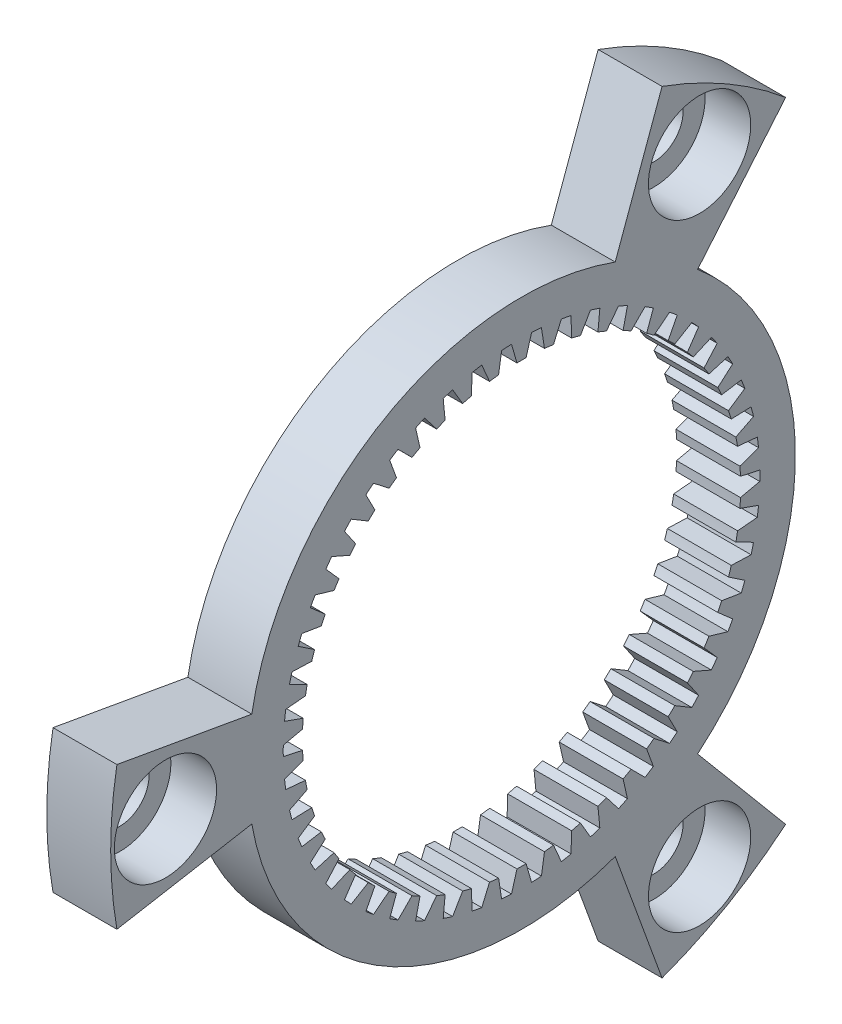
from build123d import *

# Parameters (mm, degrees)
SKETCH1_W                                        = 3.5
SKETCH1_H                                        = 22.5
CUT_EXTRUDE1_DEPTH                               = 33.011716605
CUT_EXTRUDE2_DEPTH                               = 33.011716605
CUT_EXTRUDE3_DEPTH                               = 33.011716605
CUT_EXTRUDE4_DEPTH                               = 32.07297861
CBORE_FOR_M3_HEX_HEAD_MACHINE_SCREW1_D           = 3.2
CBORE_FOR_M3_HEX_HEAD_MACHINE_SCREW1_CBORE_D     = 5.6
CBORE_FOR_M3_HEX_HEAD_MACHINE_SCREW1_CBORE_DEPTH = 2.5


with BuildPart() as part:
    # Sketch1 → Revolve1 (revolve)
    with BuildSketch(Plane.XY, mode=Mode.PRIVATE) as revolve1_sk:
        with Locations((0.25, 11.25)):
            Rectangle(SKETCH1_W, SKETCH1_H)
    revolve(revolve1_sk.sketch.rotate(Axis((-1.5, 0, 0), (1, 0, 0)), 270), axis=Axis((-1.5, 0, 0), (1, 0, 0)))

    # Sketch2 → Cut-Extrude1 (cut, through all)
    with BuildSketch(Plane.ZY.offset(1.5)):
        with BuildLine():
            Line((22.158174437, -3.907084003), (14.77211629, -2.604722668))
            ThreePointArc((14.77211629, -2.604722668), (7.499999995, -12.990381056), (-5.130302151, -14.095389311))
            Line((-5.130302151, -14.095389311), (-7.695453225, -21.143083968))
            ThreePointArc((-7.695453225, -21.143083968), (11.249999994, -19.485571584), (22.158174437, -3.907084003))
        make_face()
    extrude(amount=-CUT_EXTRUDE1_DEPTH, mode=Mode.SUBTRACT)

    # Sketch3 → Cut-Extrude2 (cut, through all)
    with BuildSketch(Plane.ZY.offset(1.5)):
        with BuildLine():
            Line((-14.462721218, -17.23599997), (-9.641814144, -11.490666648))
            ThreePointArc((-9.641814144, -11.490666648), (-14.999999996, -2e-09), (-9.641814142, 11.490666643))
            Line((-9.641814142, 11.490666643), (-14.462721215, 17.235999966))
            ThreePointArc((-14.462721215, 17.235999966), (-22.499999996, -1e-09), (-14.462721218, -17.23599997))
        make_face()
    extrude(amount=-CUT_EXTRUDE2_DEPTH, mode=Mode.SUBTRACT)

    # Sketch4 → Cut-Extrude3 (cut, through all)
    with BuildSketch(Plane.ZY.offset(1.5)):
        with BuildLine():
            Line((-7.695453229, 21.143083966), (-5.130302153, 14.095389311))
            ThreePointArc((-5.130302153, 14.095389311), (7.500000001, 12.990381056), (14.772116296, 2.60472266))
            Line((14.772116296, 2.60472266), (22.158174444, 3.90708399))
            ThreePointArc((22.158174444, 3.90708399), (11.250000001, 19.485571584), (-7.695453229, 21.143083966))
        make_face()
    extrude(amount=-CUT_EXTRUDE3_DEPTH, mode=Mode.SUBTRACT)

    # Sketch5 → Cut-Extrude4 (cut, through all)
    with BuildSketch(Plane.ZY.offset(1.5)):
        with BuildLine():
            Line((11.958023801, 1.002829383), (12.978235019, 1.366717155))
            ThreePointArc((12.978235019, 1.366717155), (12.947096852, 1.635598699), (12.910388636, 1.903776582))
            Line((12.910388636, 1.903776582), (11.83173402, 2.002515937))
            ThreePointArc((11.83173402, 2.002515937), (11.787447009, 2.248575775), (11.738043363, 2.493659563))
            Line((11.738043363, 2.493659563), (12.704602679, 2.982544343))
            ThreePointArc((12.704602679, 2.982544343), (12.640010253, 3.245403028), (12.569979891, 3.506865488))
            Line((12.569979891, 3.506865488), (11.487455466, 3.469634984))
            ThreePointArc((11.487455466, 3.469634984), (11.412678196, 3.708203932), (11.332946969, 3.945163242))
            Line((11.332946969, 3.945163242), (12.230611166, 4.551335025))
            ThreePointArc((12.230611166, 4.551335025), (12.133583141, 4.804025412), (12.031335054, 5.05464903))
            Line((12.031335054, 5.05464903), (10.962012876, 4.882035815))
            ThreePointArc((10.962012876, 4.882035815), (10.85792463, 5.109351498), (10.749123231, 5.33444934))
            Line((10.749123231, 5.33444934), (11.563735608, 6.048348435))
            ThreePointArc((11.563735608, 6.048348435), (11.435802174, 6.286885447), (11.302948875, 6.522717741))
            Line((11.302948875, 6.522717741), (10.263692795, 6.217444025))
            ThreePointArc((10.263692795, 6.217444025), (10.131935106, 6.429921539), (9.995779399, 6.639607986))
            Line((9.995779399, 6.639607986), (10.714493032, 7.449975777))
            ThreePointArc((10.714493032, 7.449975777), (10.557671777, 7.670597542), (10.396308442, 7.887919293))
            Line((10.396308442, 7.887919293), (9.403508148, 7.454799428))
            ThreePointArc((9.403508148, 7.454799428), (9.246158914, 7.649087876), (9.084796155, 7.840056047))
            Line((9.084796155, 7.840056047), (9.6962765, 8.73411255))
            ThreePointArc((9.6962765, 8.73411255), (9.513040588, 8.933339732), (9.325712014, 9.128723647))
            Line((9.325712014, 9.128723647), (8.39502456, 8.574588191))
            ThreePointArc((8.39502456, 8.574588191), (8.21456527, 8.74762353), (8.030540244, 8.916861745))
            Line((8.030540244, 8.916861745), (8.525143895, 9.880507151))
            ThreePointArc((8.525143895, 9.880507151), (8.318383067, 10.055197817), (8.108043537, 10.225562576))
            Line((8.108043537, 10.225562576), (7.254146419, 9.559150576))
            ThreePointArc((7.254146419, 9.559150576), (7.053423027, 9.708203933), (6.849637921, 9.853043203))
            Line((6.849637921, 9.853043203), (7.219564679, 10.871080252))
            ThreePointArc((7.219564679, 10.871080252), (6.992539674, 11.018479428), (6.762506366, 11.161138278))
            Line((6.762506366, 11.161138278), (5.998866056, 10.392959446))
            ThreePointArc((5.998866056, 10.392959446), (5.781044088, 10.515680161), (5.560712715, 10.633836283))
            Line((5.560712715, 10.633836283), (5.800128615, 11.690209923))
            ThreePointArc((5.800128615, 11.690209923), (5.556419755, 11.807993035), (5.310320434, 11.920696158))
            Line((5.310320434, 11.920696158), (4.648979992, 11.062865137))
            ThreePointArc((4.648979992, 11.062865137), (4.417494632, 11.157317831), (4.184091749, 11.246927413))
            Line((4.184091749, 11.246927413), (4.289221057, 12.324978001))
            ThreePointArc((4.289221057, 12.324978001), (4.032671777, 12.411287537), (3.774387577, 12.492257539))
            Line((3.774387577, 12.492257539), (3.225776736, 11.558302836))
            ThreePointArc((3.225776736, 11.558302836), (2.984278646, 11.622997933), (2.741485156, 11.682647779))
            Line((2.741485156, 11.682647779), (2.710669922, 12.765373812))
            ThreePointArc((2.710669922, 12.765373812), (2.445326155, 12.818848622), (2.17893037, 12.866808557))
            Line((2.17893037, 12.866808557), (1.751701054, 11.871459195))
            ThreePointArc((1.751701054, 11.871459195), (1.503998804, 11.905376416), (1.255643705, 11.934125811))
            Line((1.255643705, 11.934125811), (1.089369902, 13.004452054))
            ThreePointArc((1.089369902, 13.004452054), (0.81941628, 13.024248806), (0.549110132, 13.038442317))
            Line((0.549110132, 13.038442317), (0.25, 11.997395551))
            ThreePointArc((0.25, 11.997395551), (1e-09, 12), (-0.249999997, 11.997395551))
            Line((-0.249999997, 11.997395551), (-0.549110132, 13.038442317))
            ThreePointArc((-0.549110132, 13.038442317), (-0.819416279, 13.024248806), (-1.0893699, 13.004452054))
            Line((-1.0893699, 13.004452054), (-1.255643703, 11.934125812))
            ThreePointArc((-1.255643703, 11.934125812), (-1.503998803, 11.905376416), (-1.751701056, 11.871459195))
            Line((-1.751701056, 11.871459195), (-2.17893037, 12.866808557))
            ThreePointArc((-2.17893037, 12.866808557), (-2.445326153, 12.818848622), (-2.710669918, 12.765373813))
            Line((-2.710669918, 12.765373813), (-2.741485155, 11.68264778))
            ThreePointArc((-2.741485155, 11.68264778), (-2.984278646, 11.622997933), (-3.225776737, 11.558302836))
            Line((-3.225776737, 11.558302836), (-3.774387576, 12.492257539))
            ThreePointArc((-3.774387576, 12.492257539), (-4.032671778, 12.411287537), (-4.289221059, 12.324978))
            Line((-4.289221059, 12.324978), (-4.184091749, 11.246927413))
            ThreePointArc((-4.184091749, 11.246927413), (-4.417494632, 11.157317831), (-4.648979992, 11.062865137))
            Line((-4.648979992, 11.062865137), (-5.310320434, 11.920696158))
            ThreePointArc((-5.310320434, 11.920696158), (-5.556419755, 11.807993035), (-5.800128615, 11.690209923))
            Line((-5.800128615, 11.690209923), (-5.560712716, 10.633836283))
            ThreePointArc((-5.560712716, 10.633836283), (-5.781044089, 10.515680161), (-5.998866056, 10.392959446))
            Line((-5.998866056, 10.392959446), (-6.762506367, 11.161138277))
            ThreePointArc((-6.762506367, 11.161138277), (-6.992539674, 11.018479428), (-7.219564678, 10.871080253))
            Line((-7.219564678, 10.871080253), (-6.849637922, 9.853043202))
            ThreePointArc((-6.849637922, 9.853043202), (-7.053423027, 9.708203933), (-7.254146418, 9.559150576))
            Line((-7.254146418, 9.559150576), (-8.108043535, 10.225562578))
            ThreePointArc((-8.108043535, 10.225562578), (-8.318383066, 10.055197818), (-8.525143896, 9.880507151))
            Line((-8.525143896, 9.880507151), (-8.030540246, 8.916861744))
            ThreePointArc((-8.030540246, 8.916861744), (-8.21456527, 8.74762353), (-8.395024558, 8.574588192))
            Line((-8.395024558, 8.574588192), (-9.325712013, 9.128723648))
            ThreePointArc((-9.325712013, 9.128723648), (-9.513040588, 8.933339732), (-9.696276499, 8.73411255))
            Line((-9.696276499, 8.73411255), (-9.084796153, 7.840056049))
            ThreePointArc((-9.084796153, 7.840056049), (-9.246158912, 7.649087878), (-9.403508146, 7.45479943))
            Line((-9.403508146, 7.45479943), (-10.396308442, 7.887919294))
            ThreePointArc((-10.396308442, 7.887919294), (-10.557671776, 7.670597543), (-10.714493031, 7.449975778))
            Line((-10.714493031, 7.449975778), (-9.995779398, 6.639607987))
            ThreePointArc((-9.995779398, 6.639607987), (-10.131935107, 6.429921539), (-10.263692796, 6.217444023))
            Line((-10.263692796, 6.217444023), (-11.302948876, 6.52271774))
            ThreePointArc((-11.302948876, 6.52271774), (-11.435802174, 6.286885448), (-11.563735606, 6.048348438))
            Line((-11.563735606, 6.048348438), (-10.749123231, 5.334449341))
            ThreePointArc((-10.749123231, 5.334449341), (-10.85792463, 5.109351498), (-10.962012877, 4.882035814))
            Line((-10.962012877, 4.882035814), (-12.031335054, 5.054649031))
            ThreePointArc((-12.031335054, 5.054649031), (-12.133583141, 4.804025412), (-12.230611166, 4.551335023))
            Line((-12.230611166, 4.551335023), (-11.332946969, 3.945163242))
            ThreePointArc((-11.332946969, 3.945163242), (-11.412678196, 3.708203932), (-11.487455466, 3.469634984))
            Line((-11.487455466, 3.469634984), (-12.569979891, 3.506865487))
            ThreePointArc((-12.569979891, 3.506865487), (-12.640010253, 3.245403027), (-12.704602679, 2.982544343))
            Line((-12.704602679, 2.982544343), (-11.738043363, 2.493659563))
            ThreePointArc((-11.738043363, 2.493659563), (-11.787447009, 2.248575775), (-11.83173402, 2.002515937))
            Line((-11.83173402, 2.002515937), (-12.910388636, 1.90377658))
            ThreePointArc((-12.910388636, 1.90377658), (-12.947096852, 1.635598698), (-12.978235019, 1.366717156))
            Line((-12.978235019, 1.366717156), (-11.958023801, 1.002829382))
            ThreePointArc((-11.958023801, 1.002829382), (-11.976320741, 0.753486235), (-11.989419061, 0.503816019))
            Line((-11.989419061, 0.503816019), (-13.04719284, 0.270663979))
            ThreePointArc((-13.04719284, 0.270663979), (-13.05, -1e-09), (-13.04719284, -0.270663981))
            Line((-13.04719284, -0.270663981), (-11.989419061, -0.503816018))
            ThreePointArc((-11.989419061, -0.503816018), (-11.976320741, -0.753486235), (-11.958023801, -1.002829382))
            Line((-11.958023801, -1.002829382), (-12.978235019, -1.366717157))
            ThreePointArc((-12.978235019, -1.366717157), (-12.947096852, -1.635598699), (-12.910388636, -1.90377658))
            Line((-12.910388636, -1.90377658), (-11.83173402, -2.002515936))
            ThreePointArc((-11.83173402, -2.002515936), (-11.787447009, -2.248575775), (-11.738043363, -2.493659563))
            Line((-11.738043363, -2.493659563), (-12.704602679, -2.982544343))
            ThreePointArc((-12.704602679, -2.982544343), (-12.640010253, -3.245403027), (-12.569979891, -3.506865487))
            Line((-12.569979891, -3.506865487), (-11.487455466, -3.469634983))
            ThreePointArc((-11.487455466, -3.469634983), (-11.412678196, -3.708203931), (-11.332946969, -3.945163242))
            Line((-11.332946969, -3.945163242), (-12.230611166, -4.551335024))
            ThreePointArc((-12.230611166, -4.551335024), (-12.133583141, -4.804025412), (-12.031335054, -5.054649031))
            Line((-12.031335054, -5.054649031), (-10.962012877, -4.882035813))
            ThreePointArc((-10.962012877, -4.882035813), (-10.85792463, -5.109351497), (-10.749123231, -5.334449341))
            Line((-10.749123231, -5.334449341), (-11.563735609, -6.048348433))
            ThreePointArc((-11.563735609, -6.048348433), (-11.435802175, -6.286885446), (-11.302948876, -6.52271774))
            Line((-11.302948876, -6.52271774), (-10.263692794, -6.217444027))
            ThreePointArc((-10.263692794, -6.217444027), (-10.131935105, -6.429921541), (-9.995779398, -6.639607987))
            Line((-9.995779398, -6.639607987), (-10.714493034, -7.449975773))
            ThreePointArc((-10.714493034, -7.449975773), (-10.557671778, -7.670597541), (-10.396308442, -7.887919294))
            Line((-10.396308442, -7.887919294), (-9.403508147, -7.454799429))
            ThreePointArc((-9.403508147, -7.454799429), (-9.246158913, -7.649087878), (-9.084796153, -7.840056049))
            Line((-9.084796153, -7.840056049), (-9.696276504, -8.734112546))
            ThreePointArc((-9.696276504, -8.734112546), (-9.51304059, -8.93333973), (-9.325712013, -9.128723648))
            Line((-9.325712013, -9.128723648), (-8.395024559, -8.574588191))
            ThreePointArc((-8.395024559, -8.574588191), (-8.214565271, -8.747623529), (-8.030540246, -8.916861744))
            Line((-8.030540246, -8.916861744), (-8.525143893, -9.880507153))
            ThreePointArc((-8.525143893, -9.880507153), (-8.318383065, -10.055197819), (-8.108043535, -10.225562578))
            Line((-8.108043535, -10.225562578), (-7.254146419, -9.559150576))
            ThreePointArc((-7.254146419, -9.559150576), (-7.053423027, -9.708203933), (-6.849637922, -9.853043202))
            Line((-6.849637922, -9.853043202), (-7.219564677, -10.871080253))
            ThreePointArc((-7.219564677, -10.871080253), (-6.992539674, -11.018479428), (-6.762506367, -11.161138277))
            Line((-6.762506367, -11.161138277), (-5.998866057, -10.392959445))
            ThreePointArc((-5.998866057, -10.392959445), (-5.78104409, -10.51568016), (-5.560712716, -10.633836283))
            Line((-5.560712716, -10.633836283), (-5.800128615, -11.690209923))
            ThreePointArc((-5.800128615, -11.690209923), (-5.556419755, -11.807993035), (-5.310320434, -11.920696158))
            Line((-5.310320434, -11.920696158), (-4.648979993, -11.062865136))
            ThreePointArc((-4.648979993, -11.062865136), (-4.417494633, -11.15731783), (-4.184091749, -11.246927413))
            Line((-4.184091749, -11.246927413), (-4.289221058, -12.324978))
            ThreePointArc((-4.289221058, -12.324978), (-4.032671777, -12.411287537), (-3.774387576, -12.492257539))
            Line((-3.774387576, -12.492257539), (-3.225776739, -11.558302835))
            ThreePointArc((-3.225776739, -11.558302835), (-2.984278647, -11.622997933), (-2.741485155, -11.68264778))
            Line((-2.741485155, -11.68264778), (-2.710669925, -12.765373812))
            ThreePointArc((-2.710669925, -12.765373812), (-2.445326157, -12.818848622), (-2.17893037, -12.866808557))
            Line((-2.17893037, -12.866808557), (-1.751701051, -11.871459195))
            ThreePointArc((-1.751701051, -11.871459195), (-1.503998801, -11.905376416), (-1.255643703, -11.934125812))
            Line((-1.255643703, -11.934125812), (-1.089369906, -13.004452053))
            ThreePointArc((-1.089369906, -13.004452053), (-0.819416282, -13.024248806), (-0.549110132, -13.038442317))
            Line((-0.549110132, -13.038442317), (-0.249999998, -11.997395551))
            ThreePointArc((-0.249999998, -11.997395551), (1e-09, -12), (0.25, -11.997395551))
            Line((0.25, -11.997395551), (0.549110126, -13.038442317))
            ThreePointArc((0.549110126, -13.038442317), (0.819416277, -13.024248806), (1.089369902, -13.004452054))
            Line((1.089369902, -13.004452054), (1.255643704, -11.934125812))
            ThreePointArc((1.255643704, -11.934125812), (1.503998803, -11.905376416), (1.751701054, -11.871459195))
            Line((1.751701054, -11.871459195), (2.178930373, -12.866808556))
            ThreePointArc((2.178930373, -12.866808556), (2.445326157, -12.818848622), (2.710669922, -12.765373812))
            Line((2.710669922, -12.765373812), (2.741485155, -11.68264778))
            ThreePointArc((2.741485155, -11.68264778), (2.984278646, -11.622997934), (3.225776736, -11.558302836))
            Line((3.225776736, -11.558302836), (3.774387577, -12.492257539))
            ThreePointArc((3.774387577, -12.492257539), (4.032671777, -12.411287537), (4.289221057, -12.324978001))
            Line((4.289221057, -12.324978001), (4.184091748, -11.246927413))
            ThreePointArc((4.184091748, -11.246927413), (4.417494632, -11.157317831), (4.648979992, -11.062865137))
            Line((4.648979992, -11.062865137), (5.310320434, -11.920696158))
            ThreePointArc((5.310320434, -11.920696158), (5.556419755, -11.807993034), (5.800128615, -11.690209923))
            Line((5.800128615, -11.690209923), (5.560712715, -10.633836283))
            ThreePointArc((5.560712715, -10.633836283), (5.781044088, -10.515680161), (5.998866056, -10.392959446))
            Line((5.998866056, -10.392959446), (6.762506366, -11.161138277))
            ThreePointArc((6.762506366, -11.161138277), (6.992539674, -11.018479428), (7.219564679, -10.871080252))
            Line((7.219564679, -10.871080252), (6.84963792, -9.853043203))
            ThreePointArc((6.84963792, -9.853043203), (7.053423026, -9.708203933), (7.254146419, -9.559150576))
            Line((7.254146419, -9.559150576), (8.108043533, -10.225562579))
            ThreePointArc((8.108043533, -10.225562579), (8.318383065, -10.055197819), (8.525143895, -9.880507151))
            Line((8.525143895, -9.880507151), (8.030540248, -8.916861742))
            ThreePointArc((8.030540248, -8.916861742), (8.214565272, -8.747623528), (8.39502456, -8.574588191))
            Line((8.39502456, -8.574588191), (9.32571201, -9.128723651))
            ThreePointArc((9.32571201, -9.128723651), (9.513040587, -8.933339734), (9.6962765, -8.73411255))
            Line((9.6962765, -8.73411255), (9.084796154, -7.840056048))
            ThreePointArc((9.084796154, -7.840056048), (9.246158914, -7.649087876), (9.403508148, -7.454799428))
            Line((9.403508148, -7.454799428), (10.396308438, -7.887919298))
            ThreePointArc((10.396308438, -7.887919298), (10.557671775, -7.670597545), (10.714493032, -7.449975777))
            Line((10.714493032, -7.449975777), (9.995779399, -6.639607986))
            ThreePointArc((9.995779399, -6.639607986), (10.131935106, -6.429921539), (10.263692795, -6.217444025))
            Line((10.263692795, -6.217444025), (11.302948877, -6.522717737))
            ThreePointArc((11.302948877, -6.522717737), (11.435802175, -6.286885446), (11.563735608, -6.048348435))
            Line((11.563735608, -6.048348435), (10.749123231, -5.334449341))
            ThreePointArc((10.749123231, -5.334449341), (10.85792463, -5.109351498), (10.962012876, -4.882035815))
            Line((10.962012876, -4.882035815), (12.031335054, -5.05464903))
            ThreePointArc((12.031335054, -5.05464903), (12.133583141, -4.804025412), (12.230611166, -4.551335025))
            Line((12.230611166, -4.551335025), (11.332946968, -3.945163243))
            ThreePointArc((11.332946968, -3.945163243), (11.412678195, -3.708203933), (11.487455466, -3.469634984))
            Line((11.487455466, -3.469634984), (12.569979891, -3.506865487))
            ThreePointArc((12.569979891, -3.506865487), (12.640010253, -3.245403027), (12.704602679, -2.982544343))
            Line((12.704602679, -2.982544343), (11.738043362, -2.493659564))
            ThreePointArc((11.738043362, -2.493659564), (11.787447009, -2.248575776), (11.83173402, -2.002515937))
            Line((11.83173402, -2.002515937), (12.910388636, -1.903776581))
            ThreePointArc((12.910388636, -1.903776581), (12.947096852, -1.635598699), (12.978235019, -1.366717155))
            Line((12.978235019, -1.366717155), (11.958023801, -1.002829385))
            ThreePointArc((11.958023801, -1.002829385), (11.976320741, -0.753486236), (11.989419061, -0.503816018))
            Line((11.989419061, -0.503816018), (13.04719284, -0.27066398))
            ThreePointArc((13.04719284, -0.27066398), (13.05, -1e-09), (13.04719284, 0.270663979))
            Line((13.04719284, 0.270663979), (11.989419061, 0.503816018))
            ThreePointArc((11.989419061, 0.503816018), (11.976320741, 0.753486235), (11.958023801, 1.002829383))
        make_face()
    extrude(amount=-CUT_EXTRUDE4_DEPTH, mode=Mode.SUBTRACT)

    # CBORE for M3 Hex Head Machine Screw1 (through all)
    with Locations(Plane(origin=(2, 0, 0), x_dir=(0, 0, -1), z_dir=(1, 0, 0))):
        with Locations((9.75, -16.887495374), (-19.5, 0), (9.75, 16.887495374)):
            CounterBoreHole(CBORE_FOR_M3_HEX_HEAD_MACHINE_SCREW1_D / 2, CBORE_FOR_M3_HEX_HEAD_MACHINE_SCREW1_CBORE_D / 2, CBORE_FOR_M3_HEX_HEAD_MACHINE_SCREW1_CBORE_DEPTH)


solid = part.part
